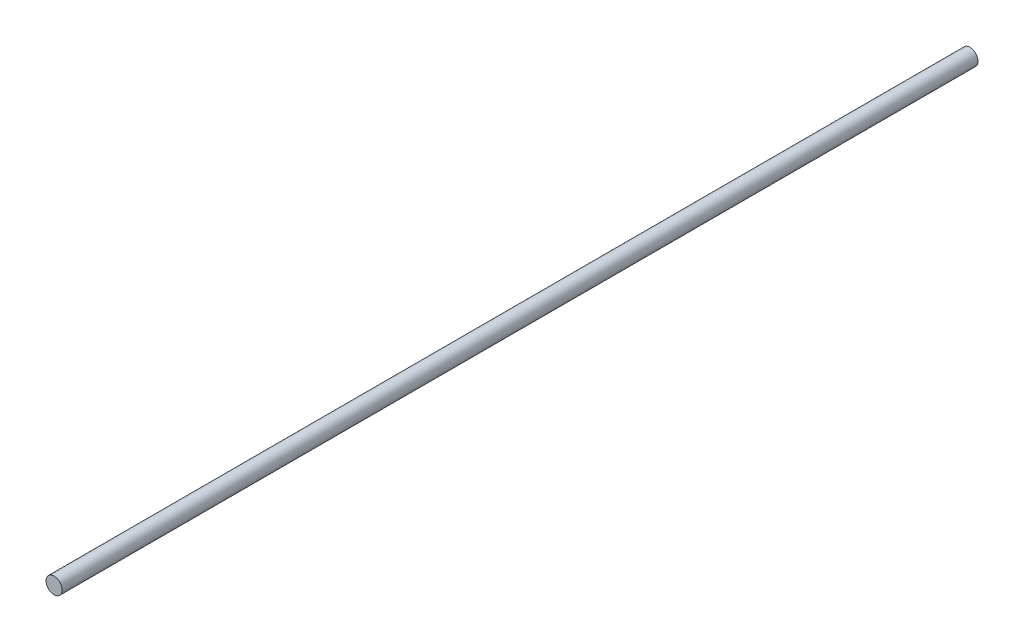
from build123d import *

# Parameters (mm, degrees)
CROQUIS1_R              = 3.175
SALIENTE_EXTRUIR1_DEPTH = 180


with BuildPart() as part:
    # Croquis1 → Saliente-Extruir1 (new, symmetric)
    with BuildSketch(Plane.XY):
        with Locations(Location((0, 0, 0), (0, 0, 180))):
            Circle(CROQUIS1_R)
    extrude(amount=SALIENTE_EXTRUIR1_DEPTH, both=True)


solid = part.part
